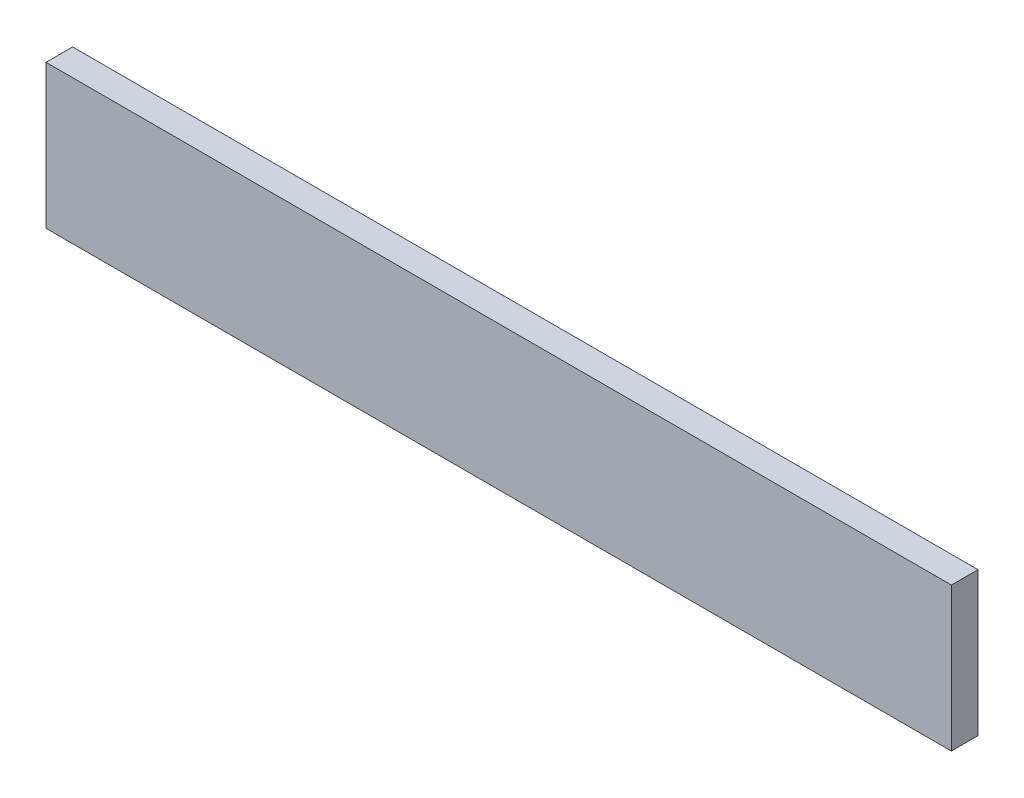
from build123d import *

# Parameters (mm, degrees)
SKETCH1_W           = 170
SKETCH1_H           = 5
BOSS_EXTRUDE1_DEPTH = 27


with BuildPart() as part:
    # Sketch1 → Boss-Extrude1 (new body)
    with BuildSketch(Plane(origin=(0, 0, 0), x_dir=(1, 0, 0), z_dir=(0, 1, 0))):
        with Locations((85, 2.5)):
            Rectangle(SKETCH1_W, SKETCH1_H)
    extrude(amount=BOSS_EXTRUDE1_DEPTH)


solid = part.part
